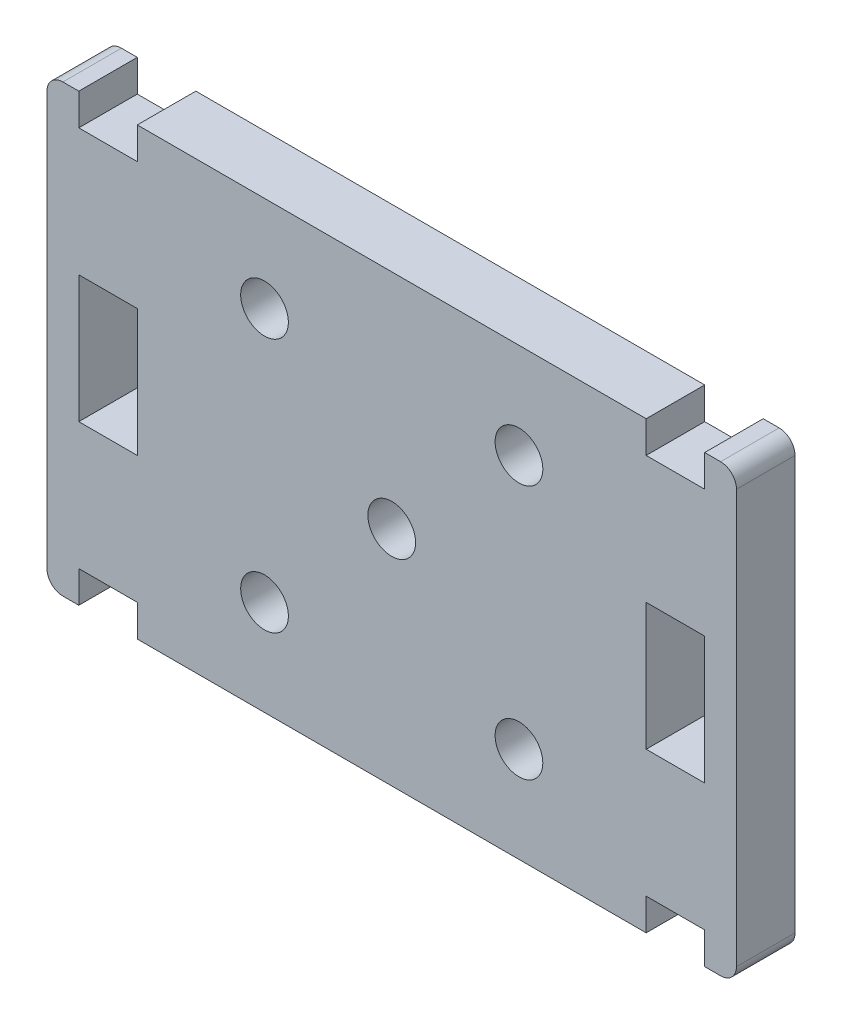
from build123d import *

# Parameters (mm, degrees)
SKETCH1_W           = 5.842
SKETCH1_H           = 12.7
BOSS_EXTRUDE1_DEPTH = 5.842
FILLET1_R           = 1.5875
SKETCH3_R           = 2.38125
CUT_EXTRUDE2_DEPTH  = 42.383686134


with BuildPart() as part:
    # Sketch1 → Boss-Extrude1 (new body)
    with BuildSketch(Plane.XY):
        Polygon((-25.4, -22.225), (25.4, -22.225), (25.4, -19.05), (31.242, -19.05), (31.242, -22.225), (34.417, -22.225), (34.417, 22.225), (31.242, 22.225), (31.242, 19.05), (25.4, 19.05), (25.4, 22.225), (-25.4, 22.225), (-25.4, 19.05), (-31.242, 19.05), (-31.242, 22.225), (-34.417, 22.225), (-34.417, -22.225), (-31.242, -22.225), (-31.242, -19.05), (-25.4, -19.05), align=None)
        with Locations((28.321, 0)):
            Rectangle(SKETCH1_W, SKETCH1_H, mode=Mode.SUBTRACT)
        with Locations((-28.321, 0)):
            Rectangle(SKETCH1_W, SKETCH1_H, mode=Mode.SUBTRACT)
    extrude(amount=BOSS_EXTRUDE1_DEPTH)

    # Fillet1
    fillet1_edges = [part.edges().sort_by_distance(p)[0] for p in [
        (34.417, 22.225, 2.921),
        (34.417, -22.225, 2.921),
        (-34.417, -22.225, 2.921),
        (-34.417, 22.225, 2.921),
    ]]
    fillet(fillet1_edges, radius=FILLET1_R)

    # Sketch3 → Cut-Extrude2 (cut, through all)
    with BuildSketch(Plane.XY.offset(5.842)):
        Circle(SKETCH3_R)
        with Locations((-12.7, 12.7)):
            Circle(SKETCH3_R)
        with Locations(Location((-12.7, -12.7, 0), (0, 0, 180))):
            Circle(SKETCH3_R)
        with Locations((12.7, -12.7)):
            Circle(SKETCH3_R)
        with Locations(Location((12.7, 12.7, 0), (0, 0, 180))):
            Circle(SKETCH3_R)
    extrude(amount=-CUT_EXTRUDE2_DEPTH, mode=Mode.SUBTRACT)


solid = part.part
